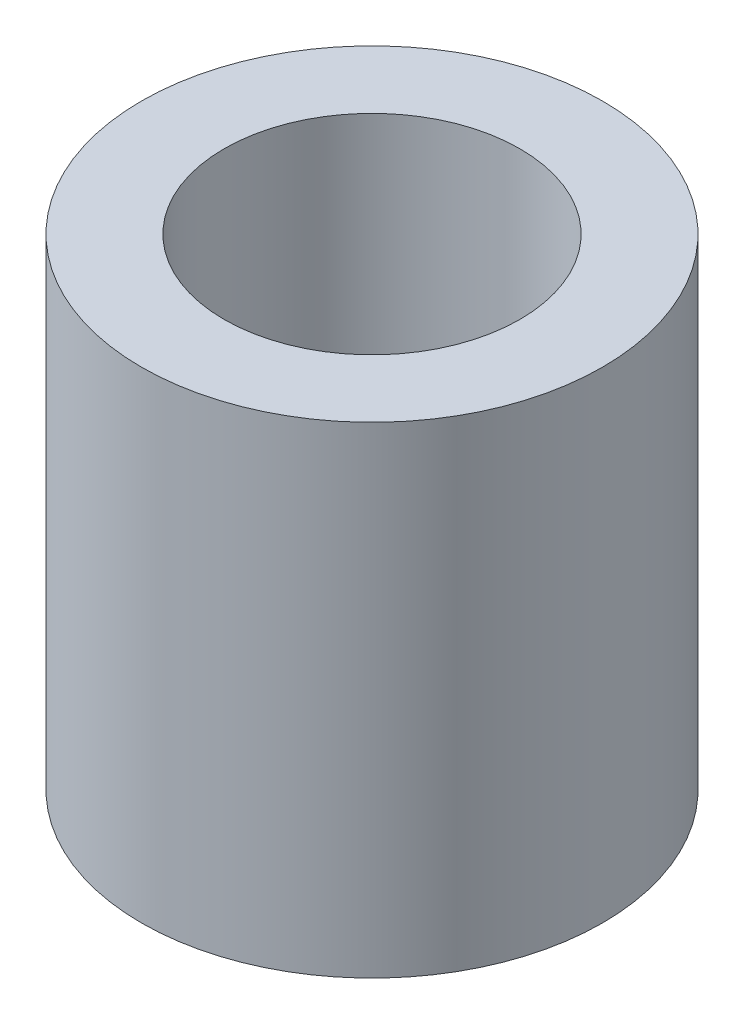
from build123d import *

# Parameters (mm, degrees)
SKETCH1_R           = 3.975
SKETCH1_R_2         = 2.55
BOSS_EXTRUDE1_DEPTH = 4.15


with BuildPart() as part:
    # Sketch1 → Boss-Extrude1 (new, symmetric)
    with BuildSketch(Plane(origin=(0, 0, 0), x_dir=(1, 0, 0), z_dir=(0, 1, 0))):
        with Locations(Location((0, 0, 0), (0, 0, 90))):
            Circle(SKETCH1_R)
        with Locations(Location((0, 0, 0), (0, 0, 90))):
            Circle(SKETCH1_R_2, mode=Mode.SUBTRACT)
    extrude(amount=BOSS_EXTRUDE1_DEPTH, both=True)


solid = part.part
